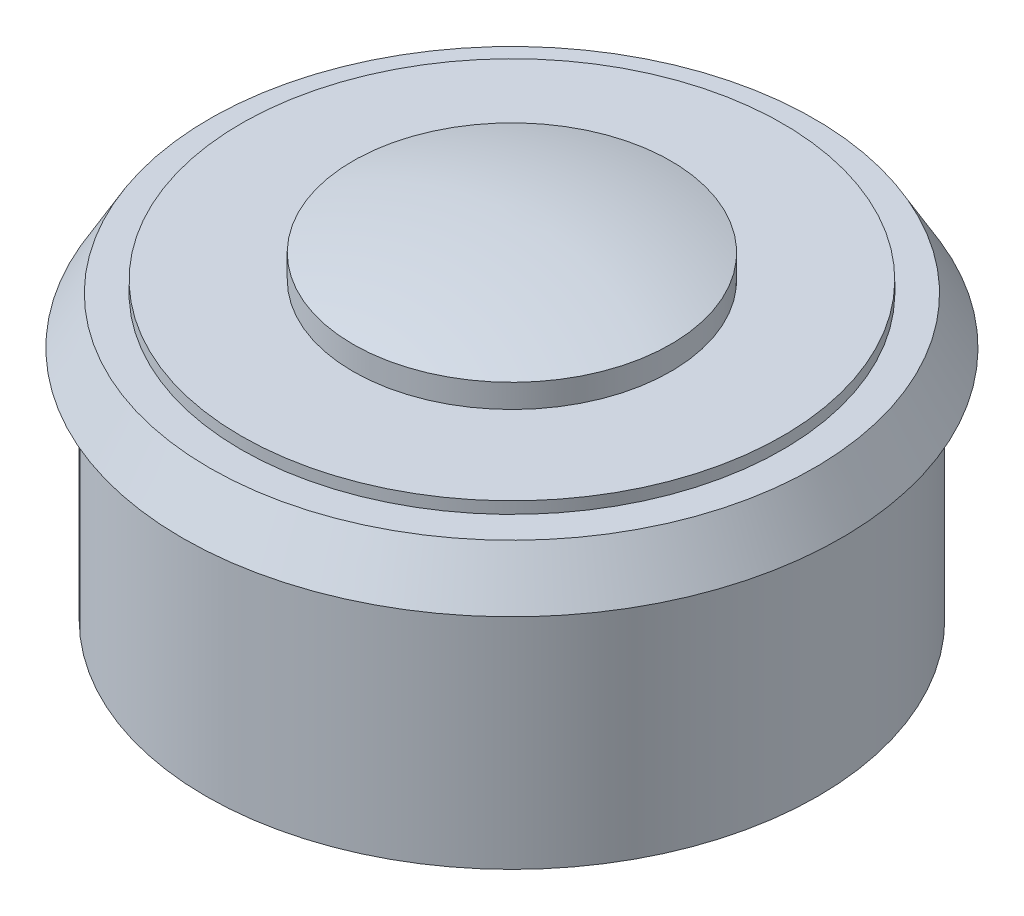
from build123d import *

# Parameters (mm, degrees)
SKETCH1_R           = 13
BOSS_EXTRUDE1_DEPTH = 10
SKETCH2_R           = 14
BOSS_EXTRUDE2_DEPTH = 2
BOSS_EXTRUDE2_TAPER = 30
SKETCH3_R           = 11.5
BOSS_EXTRUDE3_DEPTH = 0.5
SKETCH4_R           = 6.75
BOSS_EXTRUDE4_DEPTH = 1
DOME1_FACE_RADIUS   = 6.75
DOME1_HEIGHT        = 1


with BuildPart() as part:
    # Sketch1 → Boss-Extrude1 (new body)
    with BuildSketch(Plane(origin=(0, 0, 0), x_dir=(1, 0, 0), z_dir=(0, 1, 0))):
        with Locations(Location((0, 0, 0), (0, 0, 270))):
            Circle(SKETCH1_R)
    extrude(amount=BOSS_EXTRUDE1_DEPTH)


with BuildPart() as body_2:
    # Sketch2 → Boss-Extrude2 (new body)
    with BuildSketch(Plane(origin=(0, 10, 0), x_dir=(1, 0, 0), z_dir=(0, 1, 0))):
        Circle(SKETCH2_R)
    extrude(amount=BOSS_EXTRUDE2_DEPTH, taper=BOSS_EXTRUDE2_TAPER)

    # Sketch3 → Boss-Extrude3 (add)
    with BuildSketch(Plane(origin=(0, 12, 0), x_dir=(1, 0, 0), z_dir=(0, 1, 0))):
        with Locations(Location((0, 0, 0), (0, 0, 270))):
            Circle(SKETCH3_R)
    extrude(amount=BOSS_EXTRUDE3_DEPTH)

    # Sketch4 → Boss-Extrude4 (add)
    with BuildSketch(Plane(origin=(0, 12.5, 0), x_dir=(1, 0, 0), z_dir=(0, 1, 0))):
        with Locations(Location((0, 0, 0), (0, 0, 270))):
            Circle(SKETCH4_R)
    extrude(amount=BOSS_EXTRUDE4_DEPTH)

    # Dome1: a dome of height H over a round flat face of radius A is a cap of a sphere of radius (A * A + H * H) / (2 * H)
    dome1_r = (DOME1_FACE_RADIUS * DOME1_FACE_RADIUS + DOME1_HEIGHT * DOME1_HEIGHT) / (2 * DOME1_HEIGHT)
    dome1_base = Plane((0, 13.5, 0), z_dir=(0, 1, 0))
    with Locations(dome1_base.offset(DOME1_HEIGHT - dome1_r)):
        dome1_ball = Sphere(dome1_r, mode=Mode.PRIVATE)
    add(split(dome1_ball, bisect_by=dome1_base, keep=Keep.TOP, mode=Mode.PRIVATE))


solid = Compound([part.part, body_2.part])
